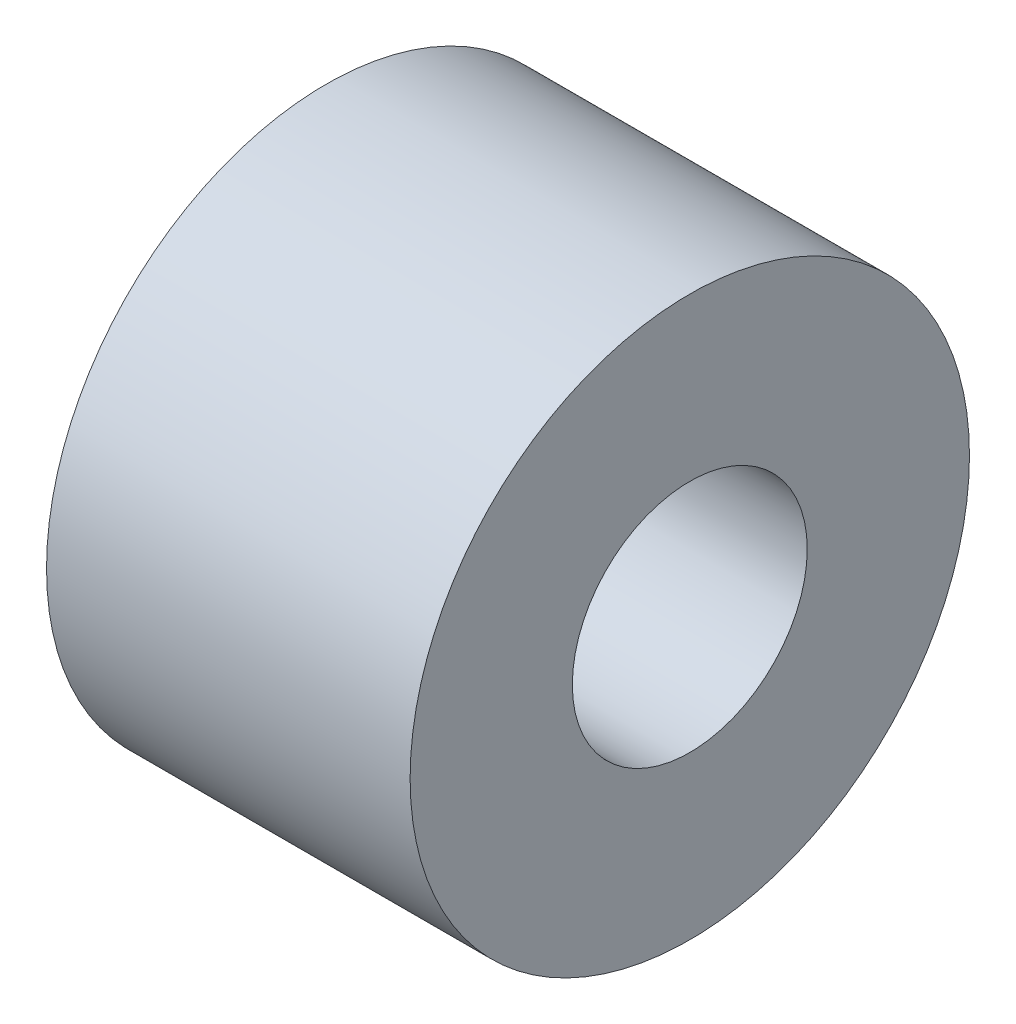
from build123d import *

# Parameters (mm, degrees)
SKETCH1_R           = 10
SKETCH1_R_2         = 4.2
BOSS_EXTRUDE1_DEPTH = 13


with BuildPart() as part:
    # Sketch1 → Boss-Extrude1 (new body)
    with BuildSketch(Plane(origin=(0, 0, 0), x_dir=(0, 0, -1), z_dir=(1, 0, 0))):
        with Locations(Location((0, 0, 0), (0, 0, 180))):
            Circle(SKETCH1_R)
        with Locations(Location((0, 0, 0), (0, 0, 180))):
            Circle(SKETCH1_R_2, mode=Mode.SUBTRACT)
    extrude(amount=BOSS_EXTRUDE1_DEPTH)


solid = part.part
